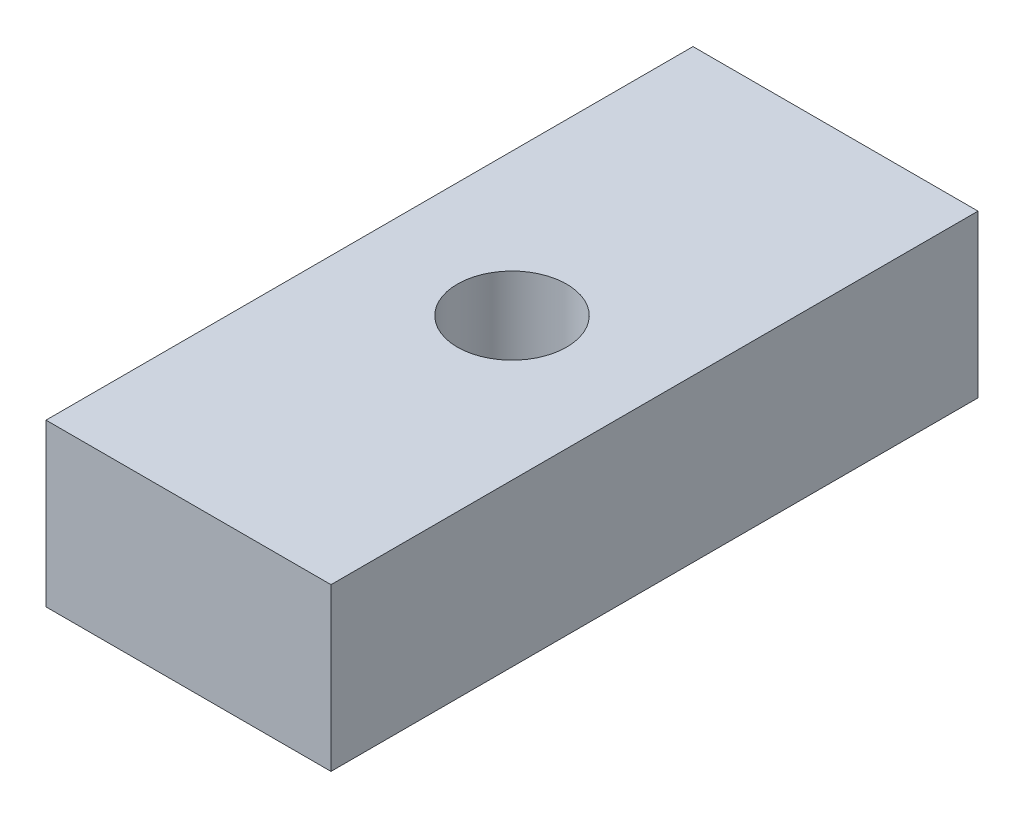
from build123d import *

# Parameters (mm, degrees)
SKETCH1_W                   = 17.61875
SKETCH1_H                   = 40
BOSS_EXTRUDE1_DEPTH         = 10
F_1_4_CLEARANCE_HOLE1_D     = 6.7564
F_1_4_CLEARANCE_HOLE1_DEPTH = 10
F_1_4_CLEARANCE_HOLE1_TIP   = 2.029827343


with BuildPart() as part:
    # Sketch1 → Boss-Extrude1 (new body)
    with BuildSketch(Plane(origin=(0, 0, 0), x_dir=(1, 0, 0), z_dir=(0, 1, 0))):
        Rectangle(SKETCH1_W, SKETCH1_H)
    extrude(amount=BOSS_EXTRUDE1_DEPTH)

    # 1/4 Clearance Hole1
    with Locations(Plane(origin=(0, 10, 0), x_dir=(1, 0, 0), z_dir=(0, 1, 0))):
        with Locations((0, 0)):
            Hole(F_1_4_CLEARANCE_HOLE1_D / 2, depth=F_1_4_CLEARANCE_HOLE1_DEPTH)
            with Locations((0, 0, -(F_1_4_CLEARANCE_HOLE1_DEPTH + F_1_4_CLEARANCE_HOLE1_TIP / 2))):  # 118° drill point
                Cone(0, F_1_4_CLEARANCE_HOLE1_D / 2, F_1_4_CLEARANCE_HOLE1_TIP, mode=Mode.SUBTRACT)


solid = part.part
